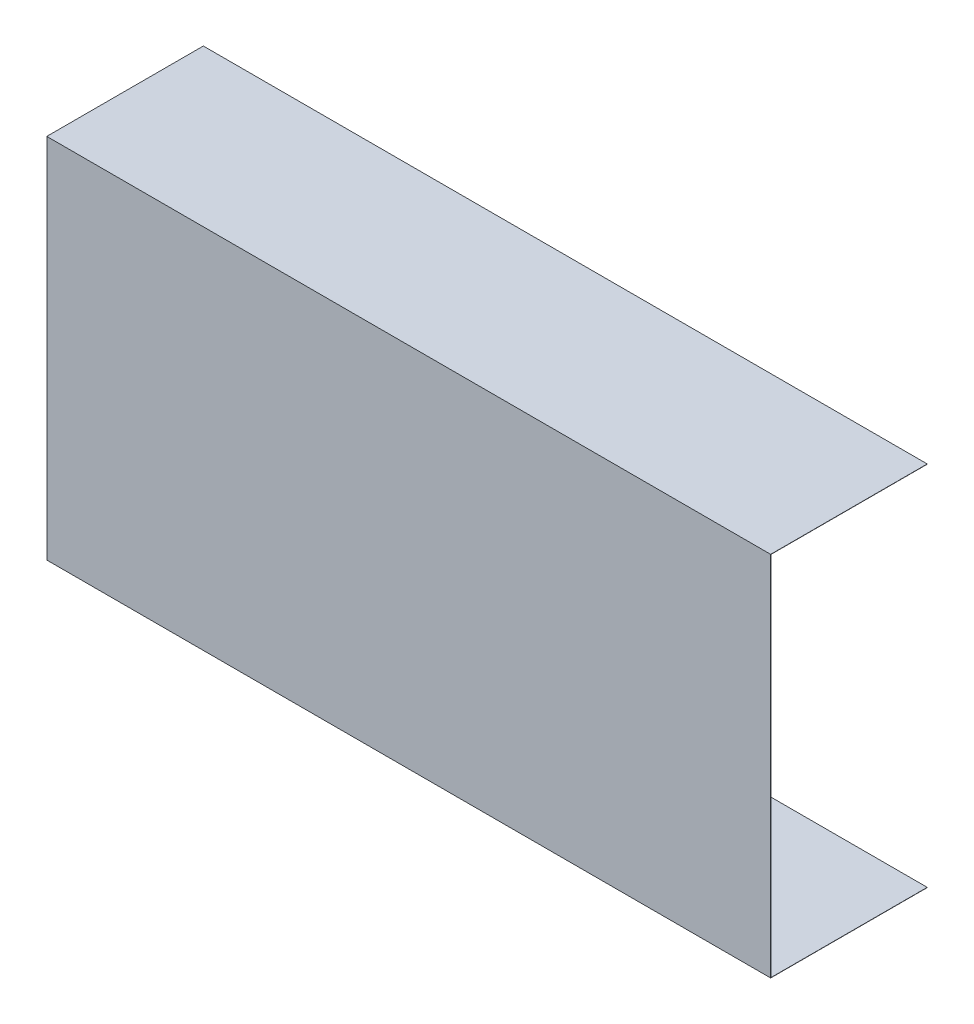
from build123d import *

# Parameters (mm, degrees)
SKETCH_1_W          = 295.949422796
SKETCH_1_H          = 458.479579913
EXTRUDE_1_DEPTH     = 64
SKETCH_2_W          = 64
SKETCH_2_H          = 308.479579913
CUT_EXTRUDE_1_DEPTH = 1028.33
SKETCH_3_W          = 63.9
SKETCH_3_H          = 149.8
CUT_EXTRUDE_2_DEPTH = 1028.33


with BuildPart() as part:
    # 스케치1 → 보스-돌출1 (new body)
    with BuildSketch(Plane.XY):
        with Locations((2908.978266494, -55.849619451)):
            Rectangle(SKETCH_1_W, SKETCH_1_H)
    extrude(amount=EXTRUDE_1_DEPTH)

    # 스케치2 → 컷-돌출1 (cut)
    with BuildSketch(Plane(origin=(3056.952977892, 0, 0), x_dir=(0, 0, -1), z_dir=(1, 0, 0))):
        with Locations((-32, 19.150380549)):
            Rectangle(SKETCH_2_W, SKETCH_2_H)
    extrude(amount=-CUT_EXTRUDE_1_DEPTH, mode=Mode.SUBTRACT)

    # 스케치3 → 컷-돌출2 (cut)
    with BuildSketch(Plane(origin=(3056.952977892, 0, 0), x_dir=(0, 0, -1), z_dir=(1, 0, 0))):
        with Locations((-31.95, -210.089409407)):
            Rectangle(SKETCH_3_W, SKETCH_3_H)
    extrude(amount=-CUT_EXTRUDE_2_DEPTH, mode=Mode.SUBTRACT)


solid = part.part
